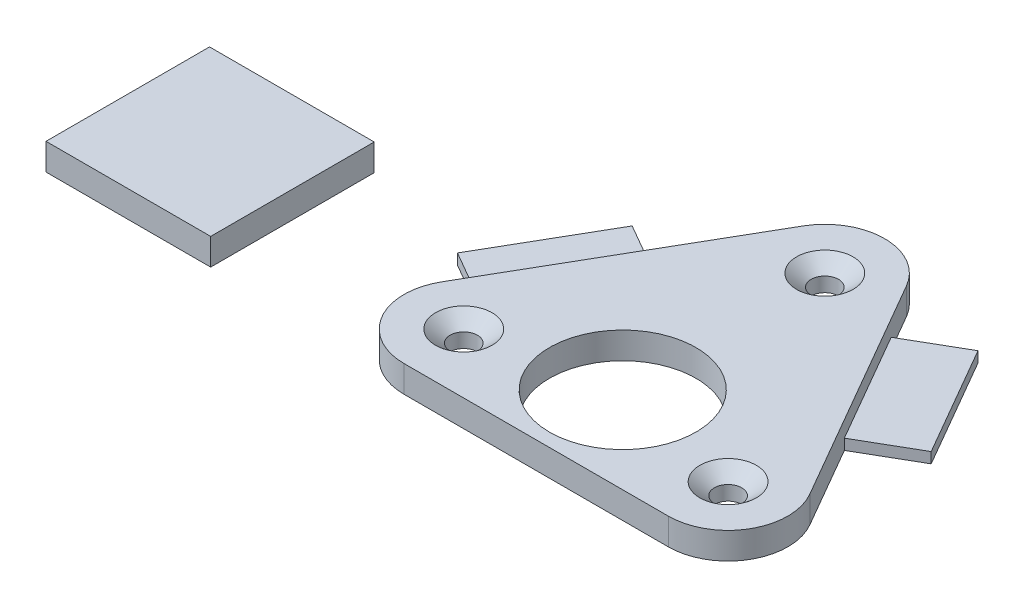
from build123d import *

# Parameters (mm, degrees)
SKETCH1_R                                         = 8.73125
BOSS_EXTRUDE1_DEPTH                               = 3.175
CSK_FOR_4_FLAT_HEAD_MACHINE_SCREW_100_D           = 3.2639
CSK_FOR_4_FLAT_HEAD_MACHINE_SCREW_100_CSINK_D     = 6.731
CSK_FOR_4_FLAT_HEAD_MACHINE_SCREW_100_CSINK_ANGLE = 100
SKETCH6_W                                         = 19.624756389
SKETCH6_H                                         = 19.488189804
BOSS_EXTRUDE2_DEPTH                               = 3.175
BOSS_EXTRUDE3_DEPTH                               = 1.27


with BuildPart() as part:
    # Sketch1 → Boss-Extrude1 (new body)
    with BuildSketch(Plane(origin=(0, 0, 0), x_dir=(1, 0, 0), z_dir=(0, 1, 0))):
        with BuildLine():
            Line((-6.171314161, 27.649879676), (-21.921198564, 0.370279676))
            ThreePointArc((-21.921198564, 0.370279676), (-21.921198564, -6.755740108), (-15.749884403, -10.31875))
            Line((-15.749884403, -10.31875), (15.749884403, -10.31875))
            ThreePointArc((15.749884403, -10.31875), (21.921198564, -6.755740108), (21.921198564, 0.370279676))
            Line((21.921198564, 0.370279676), (6.171314161, 27.649879676))
            ThreePointArc((6.171314161, 27.649879676), (0, 31.212889568), (-6.171314161, 27.649879676))
        make_face()
        with Locations(Location((0, 0, 0), (0, 0, 270))):
            Circle(SKETCH1_R, mode=Mode.SUBTRACT)
    extrude(amount=BOSS_EXTRUDE1_DEPTH)

    # CSK for #4 Flat Head Machine Screw (100)1 (through all)
    with Locations(Plane(origin=(0, 3.175, 0), x_dir=(1, 0, 0), z_dir=(0, 1, 0))):
        with Locations((0, 24.086869784), (-15.749884403, -3.192730216), (15.749884403, -3.192730216)):
            CounterSinkHole(CSK_FOR_4_FLAT_HEAD_MACHINE_SCREW_100_D / 2, CSK_FOR_4_FLAT_HEAD_MACHINE_SCREW_100_CSINK_D / 2, counter_sink_angle=CSK_FOR_4_FLAT_HEAD_MACHINE_SCREW_100_CSINK_ANGLE)

    # Sketch7 → Boss-Extrude3 (add)
    with BuildSketch(Plane.XZ):
        Polygon((16.289215205, -10.125161001), (8.669215205, -23.323388155), (15.229176289, -27.110783453), (22.849176289, -13.912556299), align=None)
        Polygon((-12.772453659, -16.216370676), (-20.392453659, -3.018143523), (-25.87549158, -6.183776942), (-18.25549158, -19.382004096), align=None)
    extrude(amount=-BOSS_EXTRUDE3_DEPTH)


with BuildPart() as body_2:
    # Sketch6 → Boss-Extrude2 (new body)
    with BuildSketch(Plane(origin=(0, 3.175, 0), x_dir=(1, 0, 0), z_dir=(0, 1, 0))):
        with Locations((-50.198654317, 1.027139445)):
            Rectangle(SKETCH6_W, SKETCH6_H)
    extrude(amount=-BOSS_EXTRUDE2_DEPTH)


solid = Compound([part.part, body_2.part])
